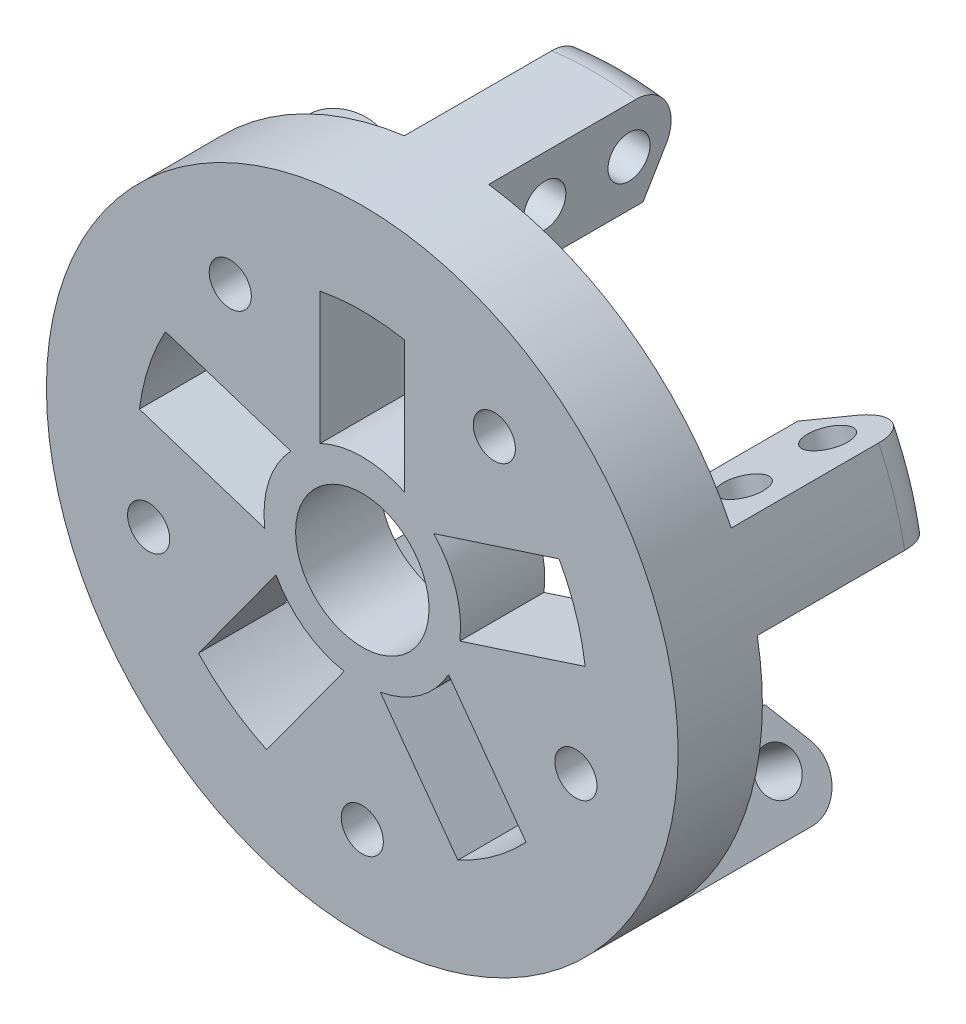
from build123d import *

# Parameters (mm, degrees)
CUT_EXTRUDE2_DEPTH      = 69.74590907246771
SKETCH3_R               = 6.000000000000004
SKETCH3_R_2             = 3.0000000000000004
CUT_EXTRUDE3_DEPTH      = 6
SKETCH3_3_R             = 3.0000000000000004
CUT_EXTRUDE4_DEPTH      = 69.74590907417863
CIRPATTERN2_COUNT       = 5
CUT_EXTRUDE5_DEPTH      = 69.74590907417863
CUT_EXTRUDE5_DEPTH_BACK = 69.74590907417863
SKETCH4_R               = 9.5
CUT_EXTRUDE6_DEPTH      = 69.74590907417863
CIRPATTERN3_COUNT       = 5
SKETCH6_R               = 3.0000000000000018
CUT_EXTRUDE7_DEPTH      = 80.2734080940737
CIRPATTERN4_COUNT       = 5


with BuildPart() as part:
    # Sketch1 → Revolve1 (revolve)
    with BuildSketch(Plane(origin=(0, 0, 0), x_dir=(1, 0, 0), z_dir=(0, 1, 0))):
        with BuildLine():
            Line((0, 0), (-45, -5.51e-15))
            Line((-45, -5.51e-15), (-45, 11.999999999999996))
            Line((-45, 11.999999999999996), (-44.99999999999999, 33))
            ThreePointArc((-44.99999999999999, 33), (-42.45437424738335, 37.35615048566752), (-37.409581178487436, 37.276649427899535))
            Line((-37.409581178487436, 37.276649427899535), (-32.00000000000002, 33.99999999999999))
            Line((-32.00000000000002, 33.99999999999999), (-32, 11.999999999999996))
            Line((-32, 11.999999999999996), (0, 11.999999999999996))
            Line((0, 11.999999999999996), (0, 0))
        make_face()
    revolve(axis=Axis((0, 0, -11.999999999999996), (0, 0, -1)))

    # Sketch2 → Cut-Extrude2 (cut, through all)
    with BuildSketch(Plane(origin=(0, 0, -11.999999999999996), x_dir=(-1, 0, 0), z_dir=(0, 0, -1))):
        with BuildLine():
            Line((-2.580858722954003, -13.760056985788697), (-21.360065941469884, -39.60741828213572))
            ThreePointArc((-21.360065941469884, -39.60741828213572), (2.76e-15, -45.00000000000001), (21.360065941469884, -39.6074182821357))
            Line((21.360065941469884, -39.6074182821357), (2.5808587229540065, -13.76005698578869))
            ThreePointArc((2.5808587229540065, -13.76005698578869), (8.6e-16, -14.000000000000004), (-2.580858722954003, -13.760056985788697))
        make_face()
        with BuildLine():
            Line((-13.88412106640061, -1.7975489460737892), (-44.269516627736664, 8.07526454963231))
            ThreePointArc((-44.269516627736664, 8.07526454963231), (-42.797543233281964, -13.905764746872519), (-31.068269873969342, -32.553995254625946))
            Line((-31.068269873969342, -32.553995254625946), (-12.289062655453392, -6.7066339582789825))
            ThreePointArc((-12.289062655453392, -6.7066339582789825), (-13.314791228132167, -4.326237921249232), (-13.88412106640061, -1.7975489460737892))
        make_face()
        with BuildLine():
            Line((-5.999999999999929, 12.649110640673554), (-5.999999999999756, 44.59820624195555))
            ThreePointArc((-5.999999999999756, 44.59820624195555), (-26.45033635316109, 36.40576474687278), (-40.56131269523718, 19.487942745174255))
            Line((-40.56131269523718, 19.487942745174255), (-10.175917133901171, 9.61512924946807))
            ThreePointArc((-10.175917133901171, 9.61512924946807), (-8.228993532094563, 11.326237921249309), (-5.999999999999929, 12.649110640673554))
        make_face()
        with BuildLine():
            Line((10.175917133901313, 9.615129249467932), (40.561312695237476, 19.487942745173687))
            ThreePointArc((40.561312695237476, 19.487942745173687), (26.45033635316161, 36.405764746872414), (6.000000000000387, 44.598206241955445))
            Line((6.000000000000387, 44.598206241955445), (6.0000000000001075, 12.649110640673463))
            ThreePointArc((6.0000000000001075, 12.649110640673463), (8.228993532094723, 11.326237921249195), (10.175917133901313, 9.615129249467932))
        make_face()
        with BuildLine():
            Line((12.289062655453302, -6.70663395827915), (31.068269873968898, -32.55399525462638))
            ThreePointArc((31.068269873968898, -32.55399525462638), (42.79754323328176, -13.90576474687311), (44.26951662773675, 8.075264549631695))
            Line((44.26951662773675, 8.075264549631695), (13.884121066400576, -1.7975489460739773))
            ThreePointArc((13.884121066400576, -1.7975489460739773), (13.314791228132103, -4.32623792124941), (12.289062655453302, -6.70663395827915))
        make_face()
    extrude(amount=CUT_EXTRUDE2_DEPTH, mode=Mode.SUBTRACT)

    # Sketch3 → Cut-Extrude3 (cut)
    with BuildSketch(Plane(origin=(0, 0, -11.999999999999996), x_dir=(-1, 0, 0), z_dir=(0, 0, -1))):
        with Locations((0, -32)):
            Circle(SKETCH3_R)
        with Locations((0, -32)):
            Circle(SKETCH3_R_2, mode=Mode.SUBTRACT)
    cut_extrude3 = extrude(amount=-CUT_EXTRUDE3_DEPTH, mode=Mode.SUBTRACT)

    # Sketch3<3> → Cut-Extrude4 (cut, symmetric)
    with BuildSketch(Plane(origin=(0, 0, -11.999999999999996), x_dir=(-1, 0, 0), z_dir=(0, 0, -1))):
        with Locations((0, -32)):
            Circle(SKETCH3_3_R)
    cut_extrude4 = extrude(amount=CUT_EXTRUDE4_DEPTH, both=True, mode=Mode.SUBTRACT)

    # CirPattern2: Cut-Extrude3, Cut-Extrude4 ×5 about axis
    cirpattern2_axis = Axis((0, 0, -11.999999999999996), (0, 0, -1))
    add([cut_extrude3.rotate(cirpattern2_axis, i * 360 / CIRPATTERN2_COUNT) for i in range(1, CIRPATTERN2_COUNT)], mode=Mode.SUBTRACT)
    add([cut_extrude4.rotate(cirpattern2_axis, i * 360 / CIRPATTERN2_COUNT) for i in range(1, CIRPATTERN2_COUNT)], mode=Mode.SUBTRACT)

    # Sketch4 → Cut-Extrude5 (cut, two sides: drawn at the far end of the back side and taken through both)
    with BuildSketch(Plane(origin=(0, 0, -11.999999999999996), x_dir=(-1, 0, 0), z_dir=(0, 0, -1)).offset(-CUT_EXTRUDE5_DEPTH_BACK)):
        Circle(SKETCH4_R)
    extrude(amount=CUT_EXTRUDE5_DEPTH + CUT_EXTRUDE5_DEPTH_BACK, mode=Mode.SUBTRACT)

    # Sketch4<4> → Cut-Extrude6 (cut, symmetric)
    with BuildSketch(Plane(origin=(0, 0, -11.999999999999996), x_dir=(-1, 0, 0), z_dir=(0, 0, -1))):
        with BuildLine():
            ThreePointArc((12.2890626554533, -6.706633958279154), (8.228993532094561, -11.326237921249309), (2.5808587229540194, -13.760056985788692))
            Line((2.580858722954019, -13.760056985788692), (13.621438750567677, -28.956111727311274))
            ThreePointArc((13.621438750567677, -28.956111727311274), (18.809128073359005, -25.888543819998425), (23.3296426830668, -21.90268869980185))
            Line((23.329642683066798, -21.902688699801853), (12.289062655453304, -6.706633958279147))
        make_face()
    cut_extrude6 = extrude(amount=CUT_EXTRUDE6_DEPTH, both=True, mode=Mode.SUBTRACT)

    # CirPattern3: Cut-Extrude6 ×5 about axis
    cirpattern3_axis = Axis((0, 0, -11.999999999999996), (0, 0, -1))
    for i in range(1, CIRPATTERN3_COUNT):
        add(cut_extrude6.rotate(cirpattern3_axis, i * 360 / CIRPATTERN3_COUNT), mode=Mode.SUBTRACT)

    # Sketch6 → Cut-Extrude7 (cut, symmetric)
    with BuildSketch(Plane(origin=(4.854101966249685, -3.52671151375484, 0), x_dir=(0, 0, -1), z_dir=(0.8090169943749475, -0.5877852522924734, 0))):
        with Locations((20.00000000000001, -38)):
            Circle(SKETCH6_R)
        with Locations((32.000000000000014, -38.00000000000001)):
            Circle(SKETCH6_R)
    cut_extrude7 = extrude(amount=CUT_EXTRUDE7_DEPTH, both=True, mode=Mode.SUBTRACT)

    # CirPattern4: Cut-Extrude7 ×5 about axis
    cirpattern4_axis = Axis((0, 0, -11.999999999999996), (0, 0, -1))
    for i in range(1, CIRPATTERN4_COUNT):
        add(cut_extrude7.rotate(cirpattern4_axis, i * 360 / CIRPATTERN4_COUNT), mode=Mode.SUBTRACT)


solid = part.part
